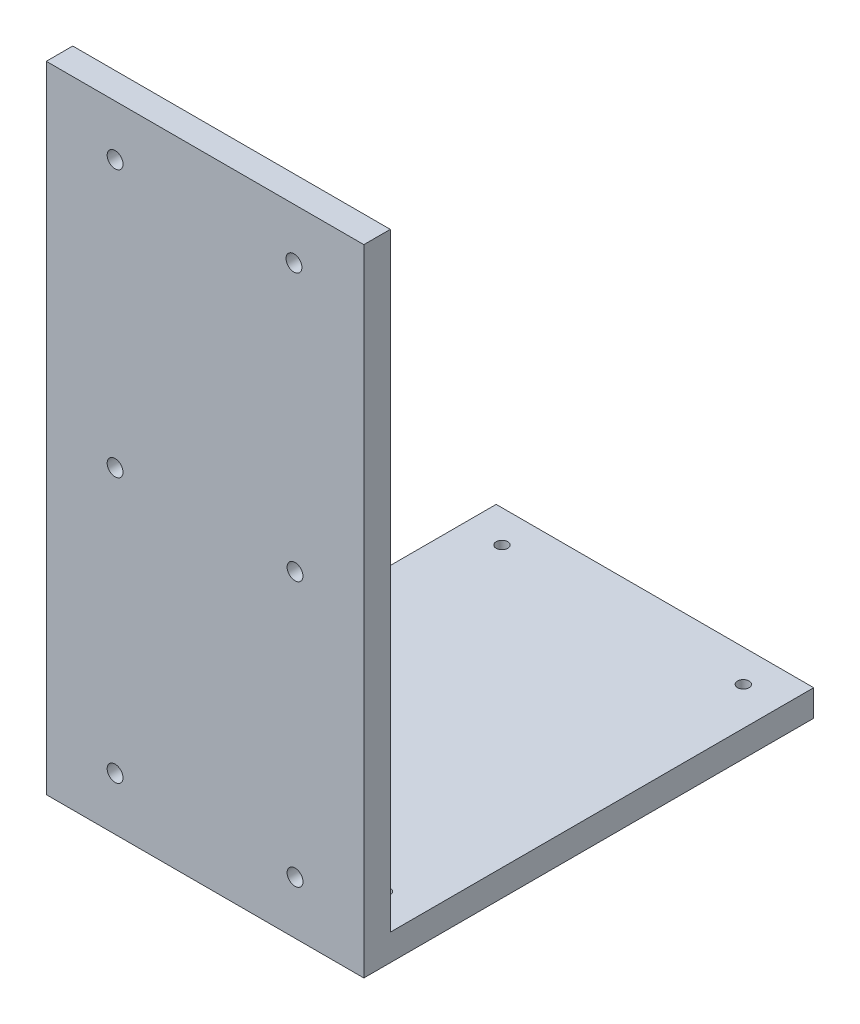
from build123d import *

# Parameters (mm, degrees)
SKETCH1_W           = 76.2
SKETCH1_H           = 152.4
BOSS_EXTRUDE1_DEPTH = 6.35
SKETCH3_W           = 76.2
SKETCH3_H           = 6.35
BOSS_EXTRUDE2_DEPTH = 101.6
SKETCH4_R           = 1.905
CUT_EXTRUDE1_DEPTH  = 191.605803952
SKETCH5_R           = 1.397
CUT_EXTRUDE2_DEPTH  = 182.94716953


with BuildPart() as part:
    # Sketch1 → Boss-Extrude1 (new body)
    with BuildSketch(Plane.XY):
        with Locations((0, 76.2)):
            Rectangle(SKETCH1_W, SKETCH1_H)
    extrude(amount=BOSS_EXTRUDE1_DEPTH)

    # Sketch3 → Boss-Extrude2 (add)
    with BuildSketch(Plane.XY):
        with Locations((0, 3.175)):
            Rectangle(SKETCH3_W, SKETCH3_H)
    extrude(amount=-BOSS_EXTRUDE2_DEPTH)

    # Sketch4 → Cut-Extrude1 (cut, through all)
    with BuildSketch(Plane.XY.offset(6.35)):
        with Locations((21.59, 76.2)):
            Circle(SKETCH4_R)
        with Locations((21.59, 12.7)):
            Circle(SKETCH4_R)
        with Locations((-21.59, 12.7)):
            Circle(SKETCH4_R)
        with Locations((-21.59, 76.2)):
            Circle(SKETCH4_R)
        with Locations((21.336, 140.208)):
            Circle(SKETCH4_R)
        with Locations((-21.59, 140.208)):
            Circle(SKETCH4_R)
    extrude(amount=-CUT_EXTRUDE1_DEPTH, mode=Mode.SUBTRACT)

    # Sketch5 → Cut-Extrude2 (cut, through all)
    with BuildSketch(Plane(origin=(0, 6.35, 0), x_dir=(1, 0, 0), z_dir=(0, 1, 0))):
        with BuildLine():
            ThreePointArc((-28.956, 92.456), (-27.968171827, 92.865171827), (-27.559, 93.853))
            Line((-27.559, 93.853), (-28.956, 93.853))
            Line((-28.956, 93.853), (-28.956, 92.456))
        make_face()
        with BuildLine():
            Line((-28.956, 93.853), (-27.559, 93.853))
            ThreePointArc((-27.559, 93.853), (-29.943828173, 94.840828173), (-28.956, 92.456))
            Line((-28.956, 92.456), (-28.956, 93.853))
        make_face()
        with BuildLine():
            ThreePointArc((30.353, 93.853), (28.956, 95.25), (27.559, 93.853))
            Line((27.559, 93.853), (28.956, 93.853))
            Line((28.956, 93.853), (28.956, 92.456))
            ThreePointArc((28.956, 92.456), (29.943828173, 92.865171827), (30.353, 93.853))
        make_face()
        with BuildLine():
            Line((28.956, 93.853), (27.559, 93.853))
            ThreePointArc((27.559, 93.853), (27.968171827, 92.865171827), (28.956, 92.456))
            Line((28.956, 92.456), (28.956, 93.853))
        make_face()
        with Locations(Location((-28.956, 7.747, 0), (0, 0, 90))):
            Circle(SKETCH5_R)
        with Locations(Location((28.956, 7.747, 0), (0, 0, 270))):
            Circle(SKETCH5_R)
    extrude(amount=-CUT_EXTRUDE2_DEPTH, mode=Mode.SUBTRACT)


solid = part.part
